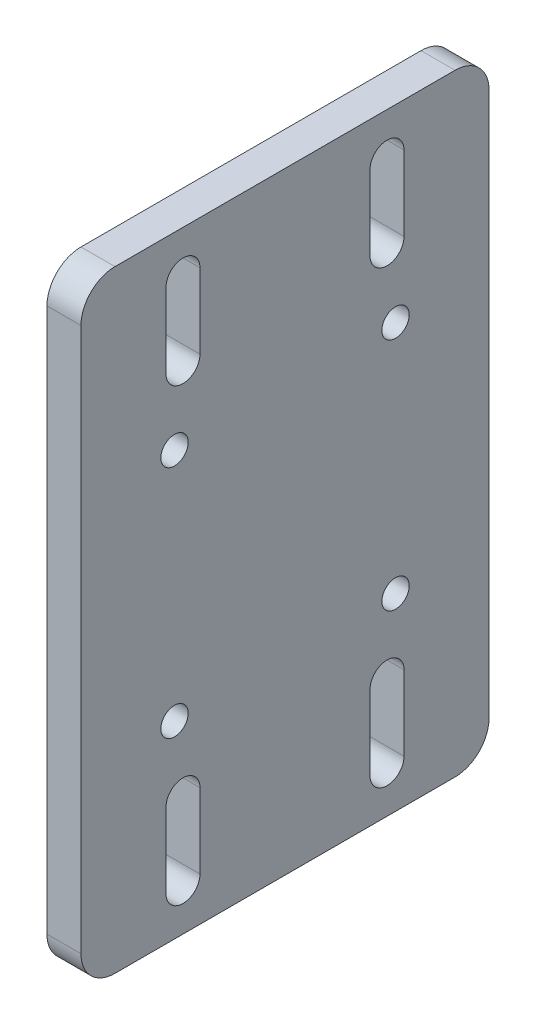
from build123d import *

# Parameters (mm, degrees)
SKETCH1_W               = 76.2
SKETCH1_H               = 114.3
BOSS_EXTRUDE1_DEPTH     = 6.35
F_1_4_20_TAPPED_HOLE1_D = 5.1054
CUT_EXTRUDE1_DEPTH      = 69.978656119
FILLET1_R               = 6.35


with BuildPart() as part:
    # Sketch1 → Boss-Extrude1 (new body)
    with BuildSketch(Plane(origin=(0, 0, 0), x_dir=(0, 0, -1), z_dir=(1, 0, 0))):
        Rectangle(SKETCH1_W, SKETCH1_H)
    extrude(amount=BOSS_EXTRUDE1_DEPTH)

    # 1/4-20 Tapped Hole1 (through all)
    with Locations(Plane(origin=(6.35, 0, 0), x_dir=(0, 0, -1), z_dir=(1, 0, 0))):
        with Locations((-20.6375, 21.9075), (20.6375, 21.9075), (20.6375, -21.9075), (-20.6375, -21.9075)):
            Hole(F_1_4_20_TAPPED_HOLE1_D / 2)

    # Sketch4 → Cut-Extrude1 (cut, through all)
    with BuildSketch(Plane(origin=(6.35, 0, 0), x_dir=(0, 0, -1), z_dir=(1, 0, 0))):
        with BuildLine():
            Line((15.875, 49.022), (15.875, 35.052))
            ThreePointArc((15.875, 35.052), (19.05, 31.877), (22.225, 35.052))
            Line((22.225, 35.052), (22.225, 49.022))
            ThreePointArc((22.225, 49.022), (19.05, 52.197), (15.875, 49.022))
        make_face()
        with BuildLine():
            Line((-22.225, 49.022), (-22.225, 35.052))
            ThreePointArc((-22.225, 35.052), (-19.05, 31.877), (-15.875, 35.052))
            Line((-15.875, 35.052), (-15.875, 49.022))
            ThreePointArc((-15.875, 49.022), (-19.05, 52.197), (-22.225, 49.022))
        make_face()
        with BuildLine():
            Line((-15.875, -49.022), (-15.875, -35.052))
            ThreePointArc((-15.875, -35.052), (-19.05, -31.877), (-22.225, -35.052))
            Line((-22.225, -35.052), (-22.225, -49.022))
            ThreePointArc((-22.225, -49.022), (-19.05, -52.197), (-15.875, -49.022))
        make_face()
        with BuildLine():
            Line((22.225, -49.022), (22.225, -35.052))
            ThreePointArc((22.225, -35.052), (19.05, -31.877), (15.875, -35.052))
            Line((15.875, -35.052), (15.875, -49.022))
            ThreePointArc((15.875, -49.022), (19.05, -52.197), (22.225, -49.022))
        make_face()
    extrude(amount=-CUT_EXTRUDE1_DEPTH, mode=Mode.SUBTRACT)

    # Fillet1
    fillet1_edges = [part.edges().sort_by_distance(p)[0] for p in [
        (3.175, -57.15, 38.1),
        (3.175, -57.15, -38.1),
        (3.175, 57.15, -38.1),
        (3.175, 57.15, 38.1),
    ]]
    fillet(fillet1_edges, radius=FILLET1_R)


solid = part.part
